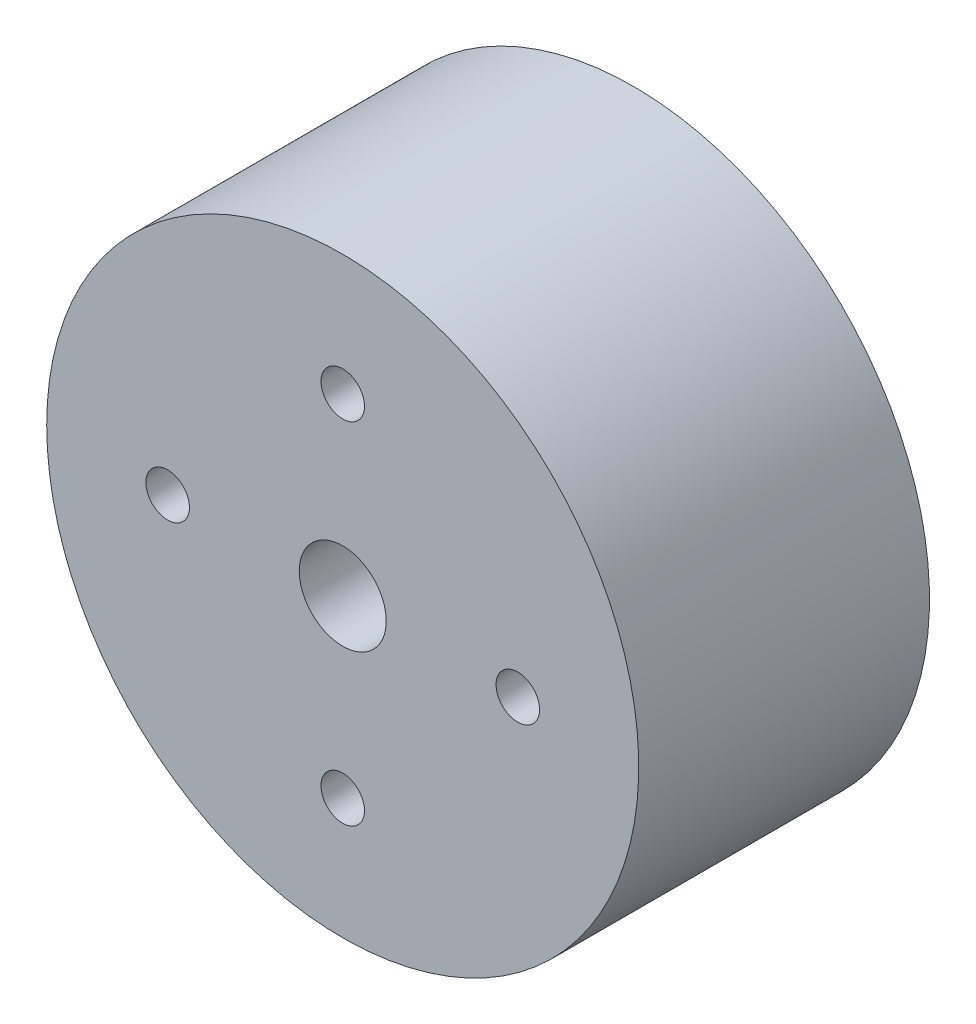
from build123d import *

# Parameters (mm, degrees)
SKETCH_1_R           = 13.95
SKETCH_1_R_2         = 2.05
EXTRUDE_1_DEPTH      = 13.7
HOLE_WIZARD_M2_5_1_D = 2.05


with BuildPart() as part:
    # 草图1 → 凸台-拉伸1 (new body)
    with BuildSketch(Plane.XY):
        with Locations(Location((0, 0, 0), (0, 0, 180))):
            Circle(SKETCH_1_R)
        with Locations(Location((0, 0, 0), (0, 0, 180))):
            Circle(SKETCH_1_R_2, mode=Mode.SUBTRACT)
    extrude(amount=EXTRUDE_1_DEPTH)

    # M2.5 螺纹孔1 (through all)
    with Locations(Plane.XY.offset(13.7)):
        with Locations((0, 8.25), (8.25, 0), (0, -8.25), (-8.25, 0)):
            Hole(HOLE_WIZARD_M2_5_1_D / 2)


solid = part.part
